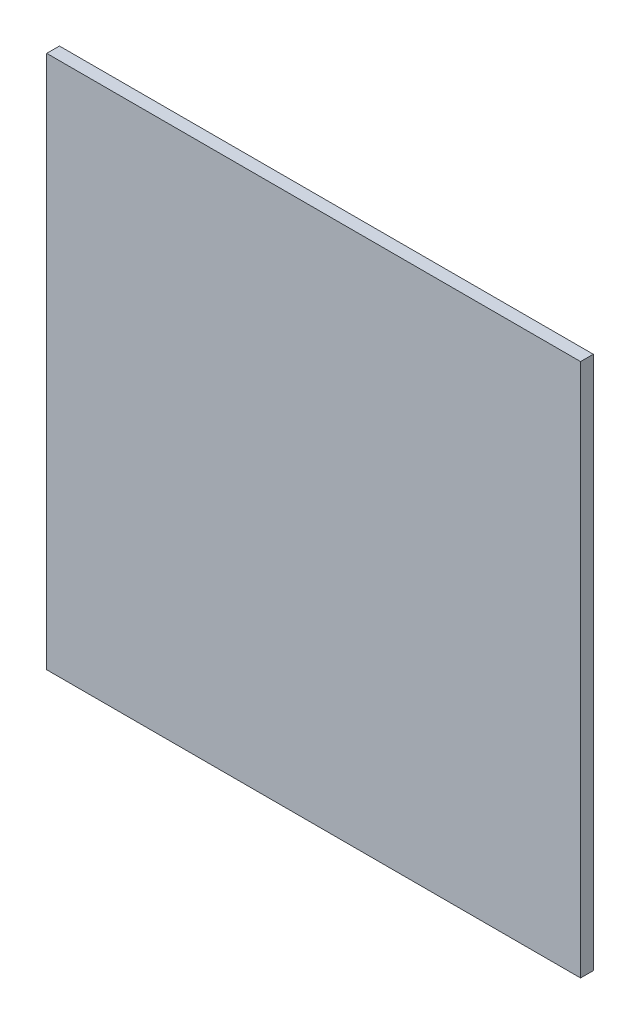
from build123d import *

# Parameters (mm, degrees)
SKETCH1_W           = 200
SKETCH1_H           = 200
BOSS_EXTRUDE1_DEPTH = 4.7625


with BuildPart() as part:
    # Sketch1 → Boss-Extrude1 (new body)
    with BuildSketch(Plane.XY):
        with Locations((-100, 104.7625)):
            Rectangle(SKETCH1_W, SKETCH1_H)
    extrude(amount=-BOSS_EXTRUDE1_DEPTH)


solid = part.part
